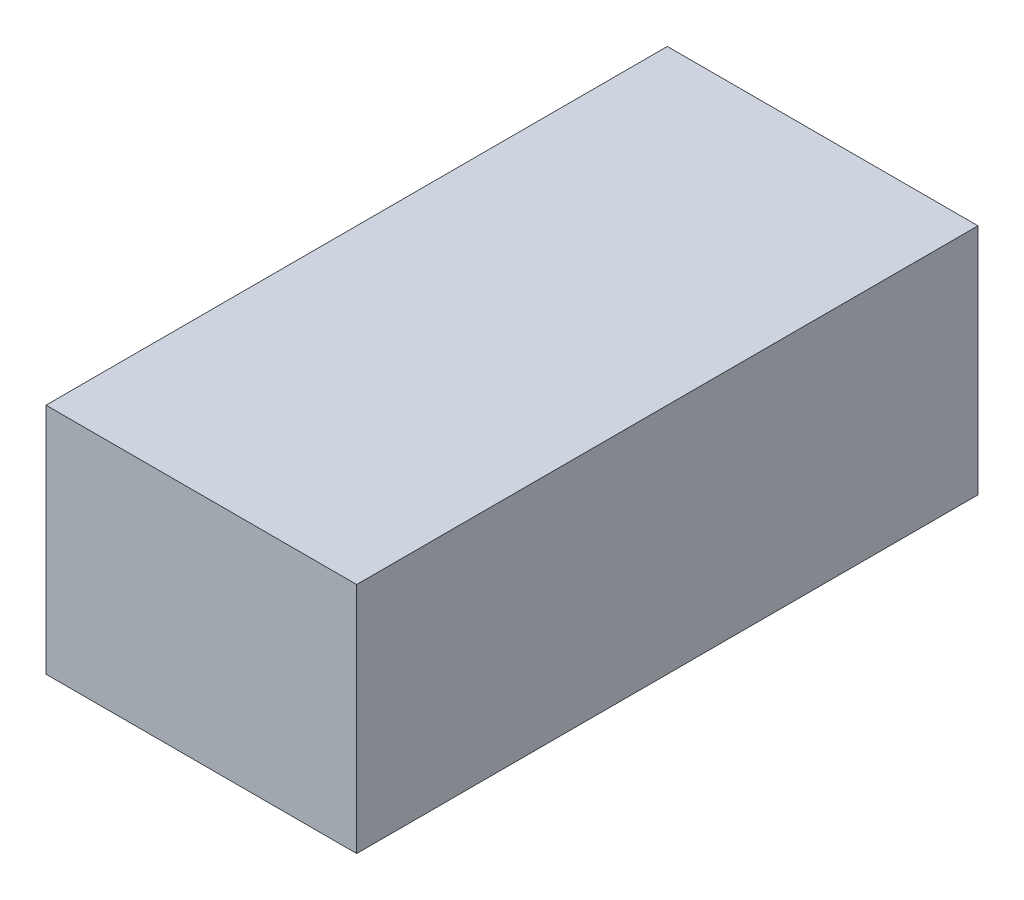
from build123d import *

# Parameters (mm, degrees)
SKETCH1_W           = 25.4
SKETCH1_H           = 50.8
BOSS_EXTRUDE1_DEPTH = 19.05


with BuildPart() as part:
    # Sketch1 → Boss-Extrude1 (new body)
    with BuildSketch(Plane(origin=(0, 0, 0), x_dir=(1, 0, 0), z_dir=(0, 1, 0))):
        Rectangle(SKETCH1_W, SKETCH1_H)
    extrude(amount=BOSS_EXTRUDE1_DEPTH)


solid = part.part
